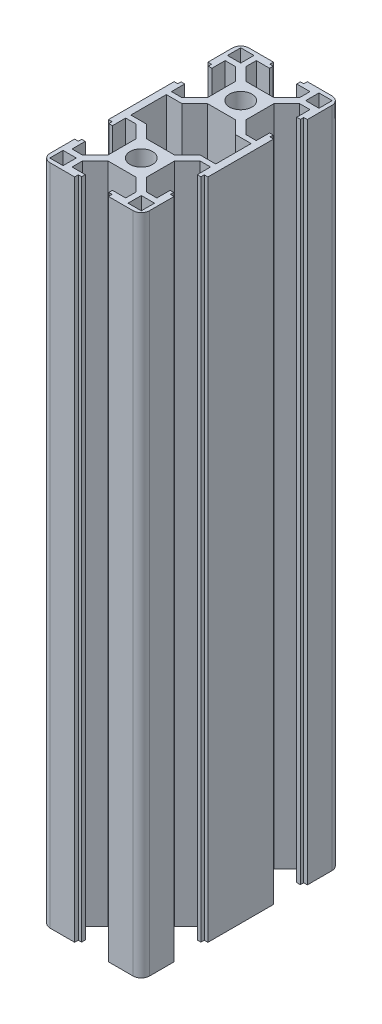
from build123d import *

# Parameters (mm, degrees)
SKETCH1_R            = 3.4
SKETCH1_W            = 4
SKETCH1_H            = 4
BOSS_EXTRUDE1_DEPTH  = 200
FILLET1_R            = 2.5
FILLET1_OF_MIRROR1_R = 2.5


with BuildPart() as part:
    # Sketch1 → Boss-Extrude1 (new body)
    with BuildSketch(Plane(origin=(0, 0, 0), x_dir=(1, 0, 0), z_dir=(0, 1, 0))):
        Polygon((-4.244365081, 20.8), (4.244365081, 20.8), (8.1, 24.655634919), (8.1, 27.8), (4.1, 27.8), (4.1, 28.9), (5.1, 28.9), (5.1, 30), (13.444365081, 30), (15, 30), (15, 28.444365081), (15, 20.1), (13.9, 20.1), (13.9, 19.1), (12.8, 19.1), (12.8, 23.1), (9.655634919, 23.1), (5.8, 19.244365081), (5.8, 10.755634919), (9.655634919, 6.9), (12.8, 6.9), (12.8, 10.9), (13.9, 10.9), (13.9, 9.9), (15, 9.9), (15, 1.555634919), (15, 0), (13.444365081, 0), (12.8, 0), (12.8, 5.344365081), (8.1, 5.344365081), (4.244365081, 9.2), (-4.244365081, 9.2), (-8.1, 5.344365081), (-12.8, 5.344365081), (-12.8, 0), (-13.444365081, 0), (-15, 0), (-15, 1.555634919), (-15, 9.9), (-13.9, 9.9), (-13.9, 10.9), (-12.8, 10.9), (-12.8, 6.9), (-9.655634919, 6.9), (-5.8, 10.755634919), (-5.8, 19.244365081), (-9.655634919, 23.1), (-12.8, 23.1), (-12.8, 19.1), (-13.9, 19.1), (-13.9, 20.1), (-15, 20.1), (-15, 28.444365081), (-15, 30), (-13.444365081, 30), (-5.1, 30), (-5.1, 28.9), (-4.1, 28.9), (-4.1, 27.8), (-8.1, 27.8), (-8.1, 24.655634919), align=None)
        with Locations(Location((0, 15, 0), (0, 0, 270))):
            Circle(SKETCH1_R, mode=Mode.SUBTRACT)
        with Locations((11.8, 26.8)):
            Rectangle(SKETCH1_W, SKETCH1_H, mode=Mode.SUBTRACT)
        with Locations((-11.8, 26.8)):
            Rectangle(SKETCH1_W, SKETCH1_H, mode=Mode.SUBTRACT)
    boss_extrude1 = extrude(amount=BOSS_EXTRUDE1_DEPTH)

    # Fillet1
    fillet1_edges = [part.edges().sort_by_distance(p)[0] for p in [
        (15, 100, -30),
        (-15, 100, -30),
    ]]
    fillet(fillet1_edges, radius=FILLET1_R)

    # Mirror1: Boss-Extrude1 across plane
    add(boss_extrude1.mirror(Plane.XY))

    # Fillet1 of Mirror1
    fillet1_of_mirror1_edges = [part.edges().sort_by_distance(p)[0] for p in [
        (15, 100, 30),
        (-15, 100, 30),
    ]]
    fillet(fillet1_of_mirror1_edges, radius=FILLET1_OF_MIRROR1_R)


solid = part.part
